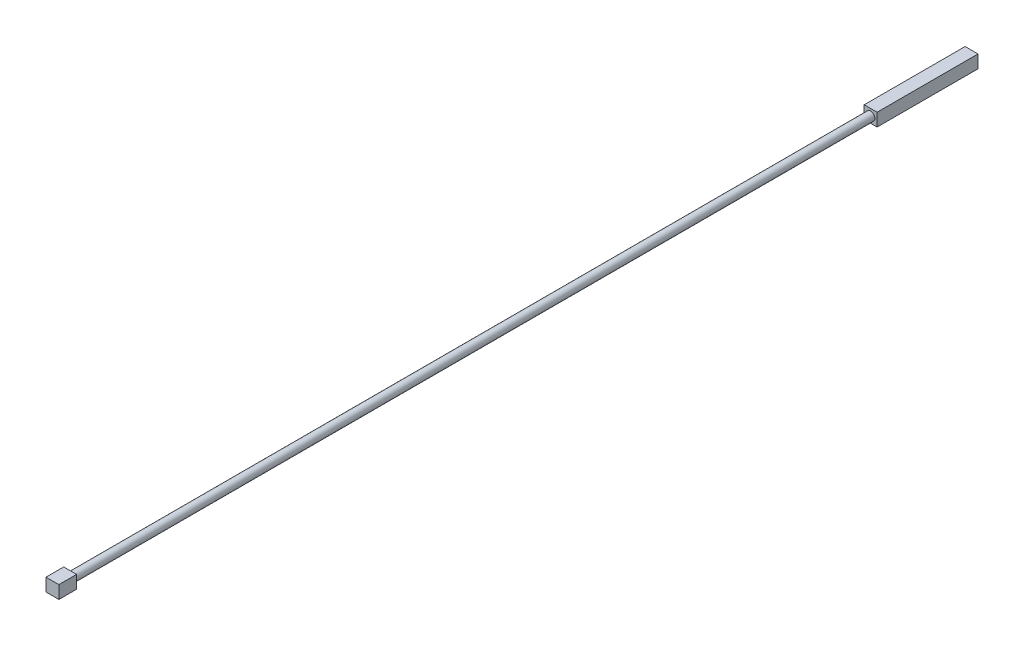
from build123d import *

# Parameters (mm, degrees)
SKETCH1_R           = 5
BOSS_EXTRUDE1_DEPTH = 1069.975
SKETCH2_W           = 15
SKETCH2_H           = 15
BOSS_EXTRUDE2_DEPTH = 117.475
SKETCH3_W           = 15
SKETCH3_H           = 15
BOSS_EXTRUDE3_DEPTH = 20.6375


with BuildPart() as part:
    # Sketch1 → Boss-Extrude1 (new body)
    with BuildSketch(Plane.XY):
        Circle(SKETCH1_R)
    extrude(amount=BOSS_EXTRUDE1_DEPTH)

    # Sketch2 → Boss-Extrude2 (add)
    with BuildSketch(Plane.XY):
        Rectangle(SKETCH2_W, SKETCH2_H)
    extrude(amount=BOSS_EXTRUDE2_DEPTH)

    # Sketch3 → Boss-Extrude3 (add)
    with BuildSketch(Plane.XY.offset(1069.975)):
        Rectangle(SKETCH3_W, SKETCH3_H)
    extrude(amount=-BOSS_EXTRUDE3_DEPTH)


solid = part.part
